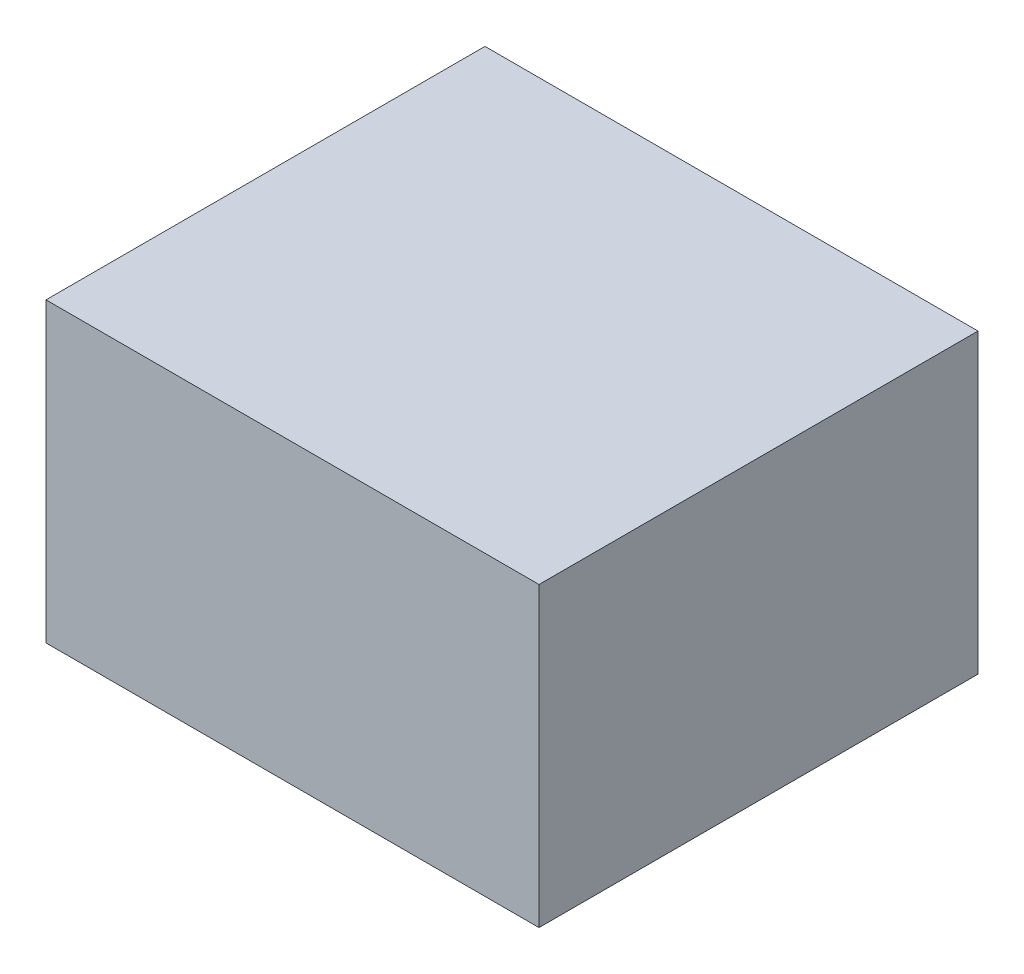
from build123d import *

# Parameters (mm, degrees)
SKETCH_1_W      = 73
SKETCH_1_H      = 65
EXTRUDE_1_DEPTH = 44


with BuildPart() as part:
    # 草图1 → 凸台-拉伸1 (new body)
    with BuildSketch(Plane(origin=(0, 0, 0), x_dir=(1, 0, 0), z_dir=(0, 1, 0))):
        Rectangle(SKETCH_1_W, SKETCH_1_H)
    extrude(amount=EXTRUDE_1_DEPTH)


solid = part.part
